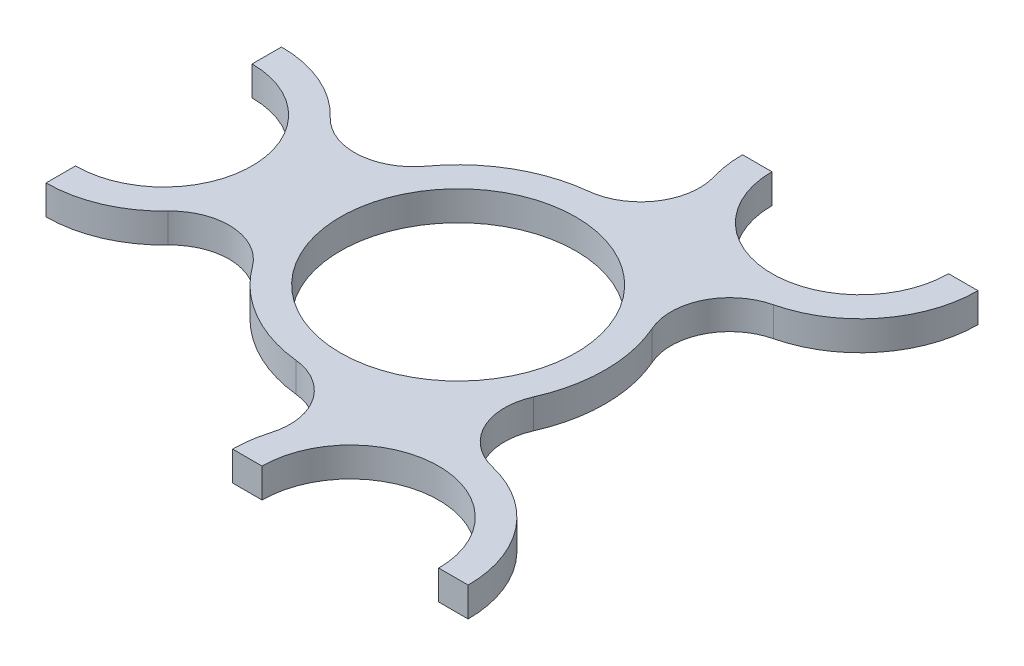
from build123d import *

# Parameters (mm, degrees)
SKETCH1_R           = 40
BOSS_EXTRUDE1_DEPTH = 10


with BuildPart() as part:
    # Sketch1 → Boss-Extrude1 (new body)
    with BuildSketch(Plane(origin=(0, 0, 0), x_dir=(1, 0, 0), z_dir=(0, 1, 0))):
        with BuildLine():
            Line((-100, 30), (-100, 40))
            ThreePointArc((-100, 40), (-84.220237409, 36.755939555), (-71, 27.549954628))
            ThreePointArc((-71, 27.549954628), (-55.218260111, 21.366045629), (-40.357142857, 29.51780853))
            ThreePointArc((-40.357142857, 29.51780853), (-25.000226369, 43.301139494), (-5.38512036, 49.709158902))
            ThreePointArc((-5.38512036, 49.709158902), (9.104684892, 58.503090991), (11.64055433, 75.261881641))
            ThreePointArc((11.64055433, 75.261881641), (10.412263093, 80.871903754), (10, 86.6))
            Line((10, 86.6), (20, 86.6))
            ThreePointArc((20, 86.6), (50, 56.6), (80, 86.6))
            Line((80, 86.6), (90, 86.6))
            ThreePointArc((90, 86.6), (81.419623277, 61.845055583), (59.359636345, 47.710448608))
            ThreePointArc((59.359636345, 47.710448608), (46.113763964, 37.135262428), (45.742467512, 20.189766365))
            ThreePointArc((45.742467512, 20.189766365), (50, 0), (45.742467512, -20.189766365))
            ThreePointArc((45.742467512, -20.189766365), (46.113763964, -37.135262428), (59.359636345, -47.710448608))
            ThreePointArc((59.359636345, -47.710448608), (81.419623277, -61.845055583), (90, -86.6))
            Line((90, -86.6), (80, -86.6))
            ThreePointArc((80, -86.6), (50, -56.6), (20, -86.6))
            Line((20, -86.6), (10, -86.6))
            ThreePointArc((10, -86.6), (10.412263093, -80.871903754), (11.64055433, -75.261881641))
            ThreePointArc((11.64055433, -75.261881641), (9.104684892, -58.503090991), (-5.38512036, -49.709158902))
            ThreePointArc((-5.38512036, -49.709158902), (-25.000226369, -43.301139494), (-40.357142857, -29.51780853))
            ThreePointArc((-40.357142857, -29.51780853), (-55.218260111, -21.366045629), (-71, -27.549954628))
            ThreePointArc((-71, -27.549954628), (-84.220237409, -36.755939555), (-100, -40))
            Line((-100, -40), (-100, -30))
            ThreePointArc((-100, -30), (-70, 0), (-100, 30))
        make_face()
        with Locations(Location((0, 0, 0), (0, 0, 270))):
            Circle(SKETCH1_R, mode=Mode.SUBTRACT)
    extrude(amount=BOSS_EXTRUDE1_DEPTH)


solid = part.part
